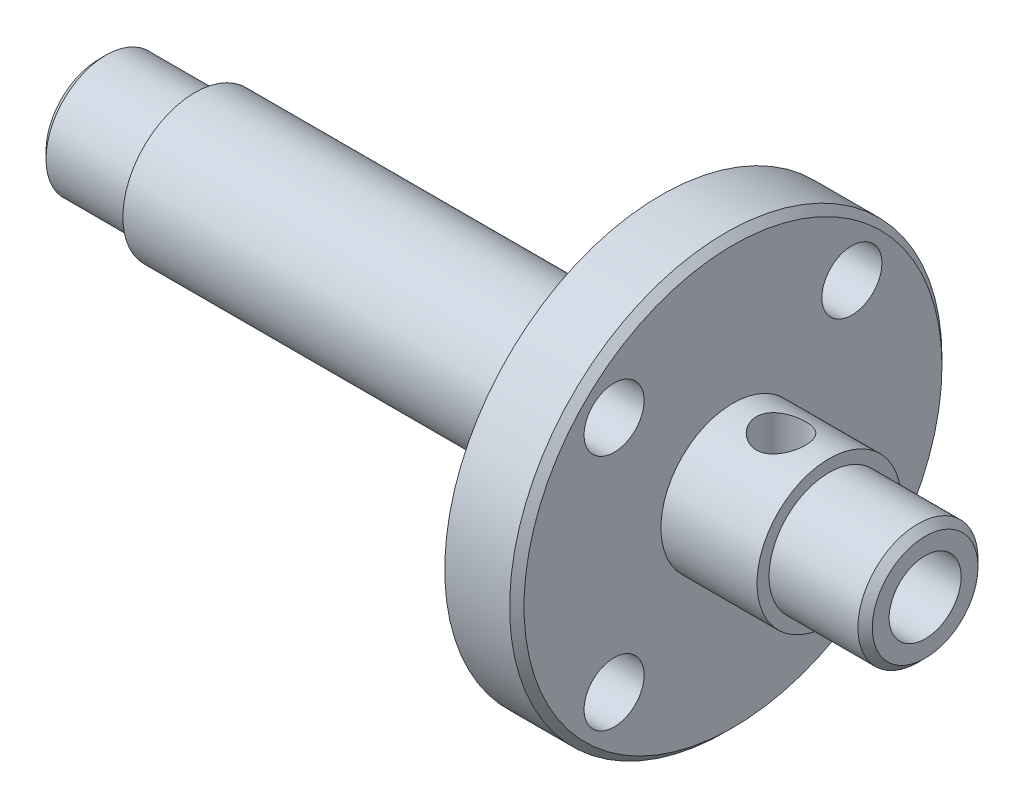
from build123d import *

# Parameters (mm, degrees)
HOLE_WIZARD_M3_1_D       = 2.5
HOLE_WIZARD_M2_5_1_D     = 2.05
HOLE_WIZARD_M2_5_1_DEPTH = 3.75
HOLE_WIZARD_M2_5_1_TIP   = 0.615882135
CHAMFER_1_SIZE           = 0.3
MM_1_D                   = 3
MM_1_DEPTH               = 10
MM_1_TIP                 = 0.901290929


with BuildPart() as part:
    # 草图1 → 旋转1 (revolve)
    with BuildSketch(Plane.XY):
        Polygon((0, 0), (0, 2.5), (4, 2.5), (4, 3), (23.4, 3), (23.4, 9), (26.4, 9), (26.4, 3), (30.4, 3), (30.4, 2.5), (34.4, 2.5), (34.4, 0), align=None)
    revolve(axis=Axis((34.4, 0, 0), (-1, 0, 0)))

    # M3 螺纹孔1 (through all)
    with Locations(Plane(origin=(26.4, 4.949747468, 4.949747468), x_dir=(0, 0, 1), z_dir=(1, 0, 0))):
        with Locations((0, 0), (-9.899494936, 0), (-9.899494936, 9.899494936), (0, 9.899494936)):
            Hole(HOLE_WIZARD_M3_1_D / 2)

    # M2.5 螺纹孔1
    with Locations(Plane(origin=(28.4, 3, 0), x_dir=(0, 0, 1), z_dir=(0, 1, 0))):
        with Locations((0, 0)):
            Hole(HOLE_WIZARD_M2_5_1_D / 2, depth=HOLE_WIZARD_M2_5_1_DEPTH)
            with Locations((0, 0, -(HOLE_WIZARD_M2_5_1_DEPTH + HOLE_WIZARD_M2_5_1_TIP / 2))):  # 118° drill point
                Cone(0, HOLE_WIZARD_M2_5_1_D / 2, HOLE_WIZARD_M2_5_1_TIP, mode=Mode.SUBTRACT)

    # 倒角1
    chamfer_1_edges = [part.edges().sort_by_distance(p)[0] for p in [
        (34.4, -2.5, 0),
        (0, -2.5, 0),
        (26.4, -9, 0),
    ]]
    chamfer(chamfer_1_edges, length=CHAMFER_1_SIZE)

    # 大小mm 暗销孔1
    with Locations(Plane(origin=(34.4, 0, 0), x_dir=(0, 0, 1), z_dir=(1, 0, 0))):
        with Locations((0, 0)):
            Hole(MM_1_D / 2, depth=MM_1_DEPTH)
            with Locations((0, 0, -(MM_1_DEPTH + MM_1_TIP / 2))):  # 118° drill point
                Cone(0, MM_1_D / 2, MM_1_TIP, mode=Mode.SUBTRACT)


solid = part.part
